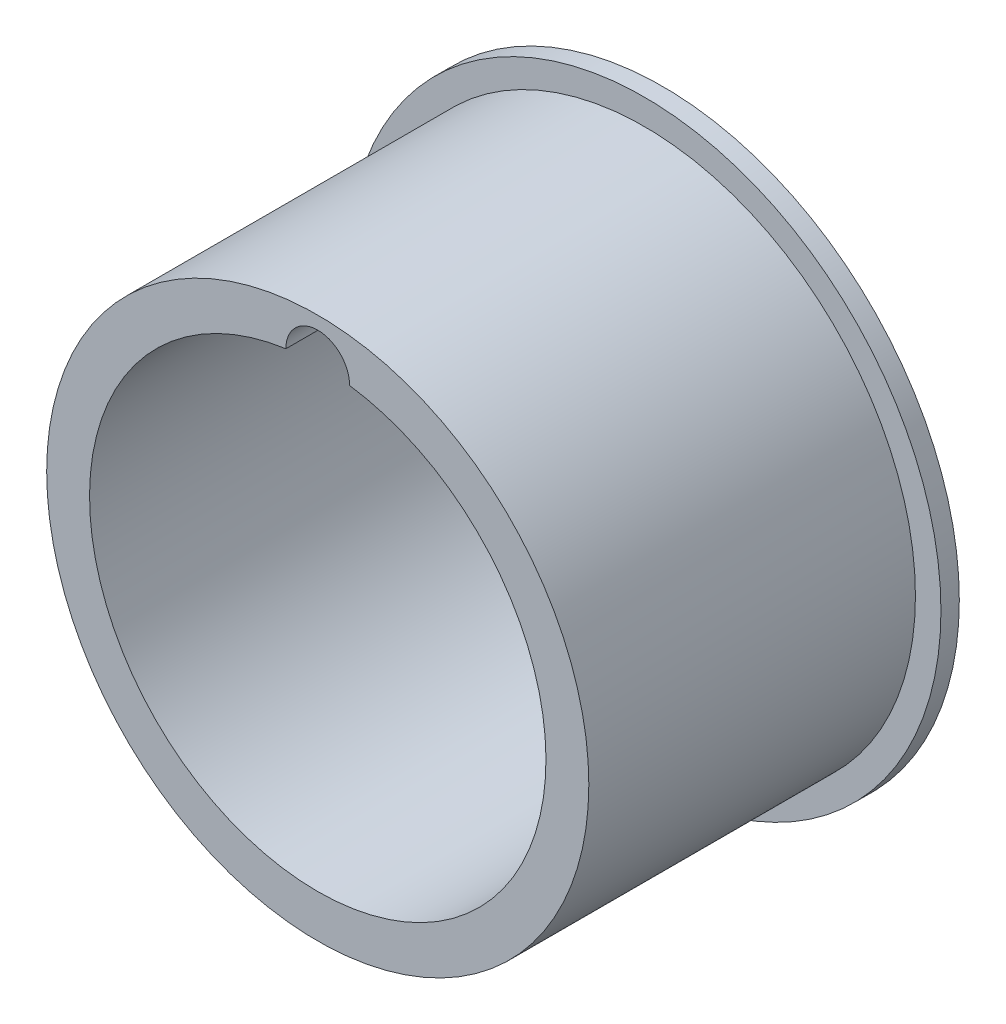
from build123d import *

# Parameters (mm, degrees)
BOSS_EXTRUDE1_DEPTH      = 40.64
BOSS_EXTRUDE1_DEPTH_BACK = 0.254
SKETCH1_R                = 33.7312
SKETCH1_R_2              = 28.3972
SKETCH3_R                = 36.9062
SKETCH3_R_2              = 28.144458554
BOSS_EXTRUDE2_DEPTH      = 2.286
CUT_EXTRUDE4_DEPTH       = 70.866
CUT_EXTRUDE4_DEPTH_BACK  = 4.064
SKETCH5_R                = 3.962523409


with BuildPart() as part:
    # Sketch1 → Boss-Extrude1 (new, two sides: drawn at the far end of the back side and taken through both)
    with BuildSketch(Plane.XY.offset(-BOSS_EXTRUDE1_DEPTH_BACK)):
        Circle(SKETCH1_R)
        Circle(SKETCH1_R_2, mode=Mode.SUBTRACT)
    extrude(amount=BOSS_EXTRUDE1_DEPTH + BOSS_EXTRUDE1_DEPTH_BACK)

    # Sketch3 → Boss-Extrude2 (add)
    with BuildSketch(Plane.XY):
        Circle(SKETCH3_R)
        Circle(SKETCH3_R_2, mode=Mode.SUBTRACT)
    extrude(amount=-BOSS_EXTRUDE2_DEPTH)

    # Sketch5 → Cut-Extrude4 (cut, two sides: drawn at the far end of the back side and taken through both)
    with BuildSketch(Plane.XY.offset(-CUT_EXTRUDE4_DEPTH_BACK)):
        with Locations((0, 28.144458554)):
            Circle(SKETCH5_R)
    extrude(amount=CUT_EXTRUDE4_DEPTH + CUT_EXTRUDE4_DEPTH_BACK, mode=Mode.SUBTRACT)


solid = part.part
